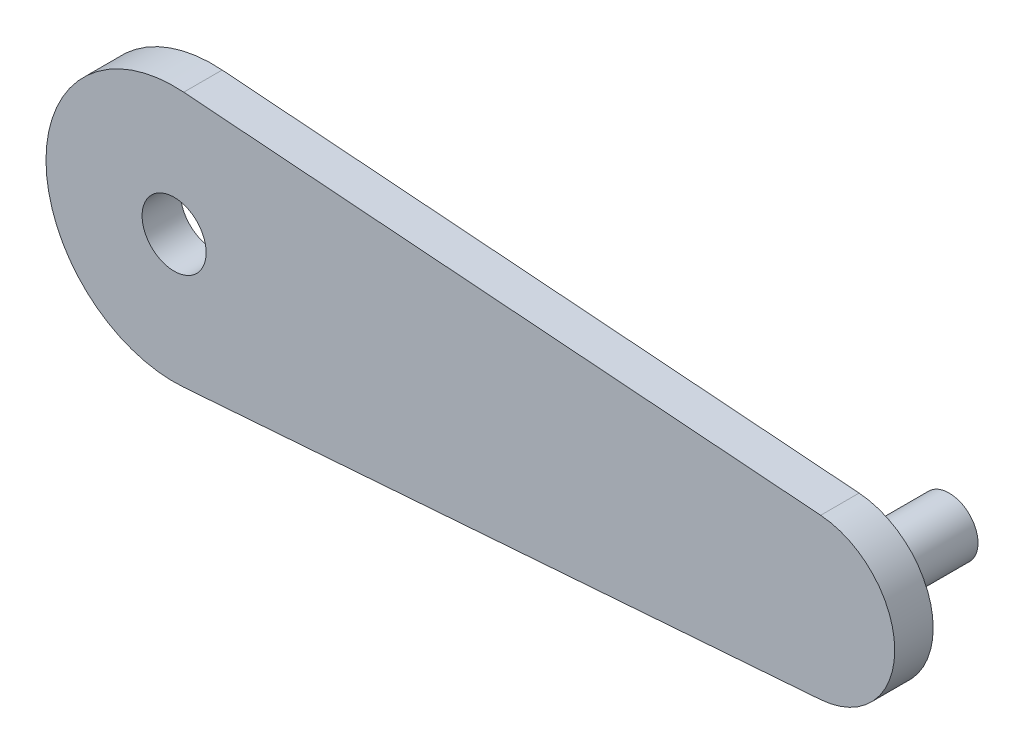
from build123d import *

# Parameters (mm, degrees)
SKETCH_1_R      = 1
EXTRUDE_1_DEPTH = 1.2
EXTRUDE_START   = -3
SKETCH_1_3_R    = 0.9
EXTRUDE_2_DEPTH = 3


with BuildPart() as part:
    # Эскиз1 → Бобышка-Вытянуть1 (new body)
    with BuildSketch(Plane.XY):
        with BuildLine():
            Line((0.3, 3.988734135), (20.1875, 2.492958834))
            ThreePointArc((20.1875, 2.492958834), (22.5, 0), (20.1875, -2.492958834))
            Line((20.1875, -2.492958834), (0.3, -3.988734135))
            ThreePointArc((0.3, -3.988734135), (-4, 0), (0.3, 3.988734135))
        make_face()
        Circle(SKETCH_1_R, mode=Mode.SUBTRACT)
    extrude(amount=EXTRUDE_1_DEPTH)

    # Эскиз1<3> → Бобышка-Вытянуть2 (add)
    with BuildSketch(Plane.XY.offset(EXTRUDE_START)):
        with Locations((20, 0)):
            Circle(SKETCH_1_3_R)
    extrude(amount=EXTRUDE_2_DEPTH)


solid = part.part
